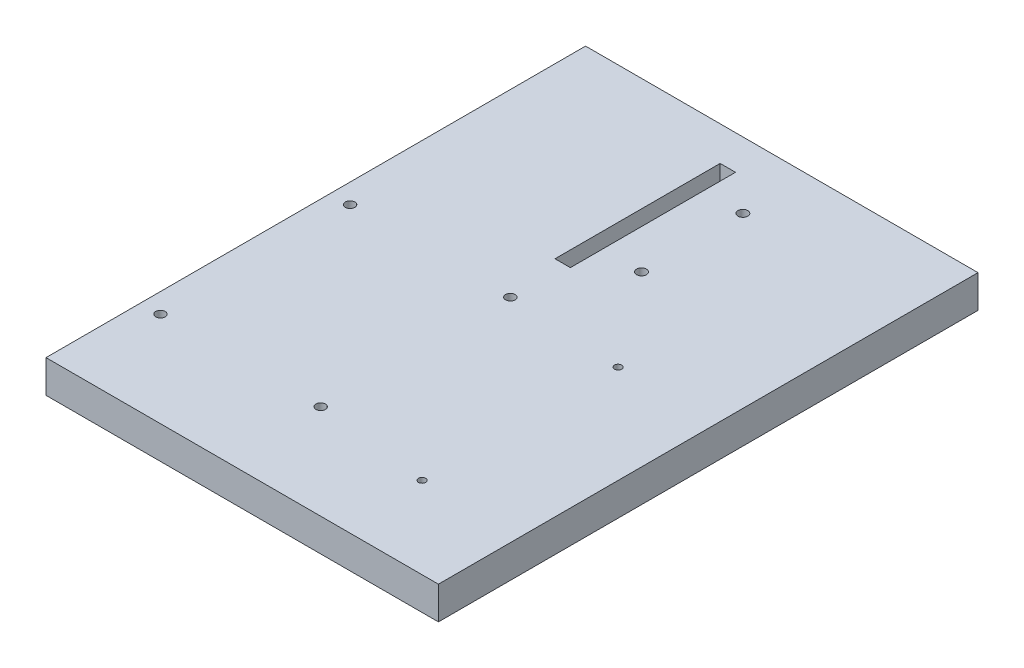
from build123d import *

# Parameters (mm, degrees)
SKETCH1_W                     = 120
SKETCH1_H                     = 165
BASE_DEPTH                    = 10
PI_MOUNTHOLES_AT_2_COUNT      = 2
PI_MOUNTHOLES_AT_2_PITCH      = 49
PI_MOUNTHOLES_AT_3_COUNT      = 2
PI_MOUNTHOLES_AT_3_PITCH      = 75.927597091
PI_MOUNTHOLES_AT_4_COUNT      = 2
PI_MOUNTHOLES_AT_4_PITCH      = 58
BATTERY_MOUNTHOLES_AT_2_COUNT = 2
BATTERY_MOUNTHOLES_AT_2_PITCH = 59.95
SKETCH17_W                    = 4.7
SKETCH17_H                    = 50.5
STEPPERBRACKETSLOT_DEPTH      = 10
SKETCH18_R                    = 1.5
ANGLEBRACKET_MOUNTHOLES_DEPTH = 10


with BuildPart() as part:
    # Sketch1 → Base (new body)
    with BuildSketch(Plane(origin=(0, 0, 0), x_dir=(1, 0, 0), z_dir=(0, 1, 0))):
        with Locations((60, 82.5)):
            Rectangle(SKETCH1_W, SKETCH1_H)
    extrude(amount=BASE_DEPTH)

    # Sketch14 → Pi-MountHoles (revolve, cut)
    with BuildSketch(Plane(origin=(6, 0, -29), x_dir=(0, 0, -1), z_dir=(1, 0, 0))):
        Polygon((0, 0), (0, 10), (1.45, 10), (1.45, 2.1), (3, 2.1), (3, 0.025), (3.025, 0), align=None)
    pi_mountholes = revolve(axis=Axis((6, -6.35, -29), (0, 1, 0)), mode=Mode.SUBTRACT)

    # Pi-MountHoles at 2: Pi-MountHoles ×2
    with Locations(*[(i * PI_MOUNTHOLES_AT_2_PITCH, 0, 0) for i in range(1, PI_MOUNTHOLES_AT_2_COUNT)]):
        add(pi_mountholes, mode=Mode.SUBTRACT)

    # Pi-MountHoles at 3: Pi-MountHoles ×2
    with Locations(*[Vector(0.6453516491682099, 0, -0.7638856255460447) * (i * PI_MOUNTHOLES_AT_3_PITCH) for i in range(1, PI_MOUNTHOLES_AT_3_COUNT)]):
        add(pi_mountholes, mode=Mode.SUBTRACT)

    # Pi-MountHoles at 4: Pi-MountHoles ×2
    with Locations(*[(0, 0, -i * PI_MOUNTHOLES_AT_4_PITCH) for i in range(1, PI_MOUNTHOLES_AT_4_COUNT)]):
        add(pi_mountholes, mode=Mode.SUBTRACT)

    # Sketch16 → Battery-MountHoles (revolve, cut)
    with BuildSketch(Plane(origin=(90, 0, -25), x_dir=(0, 0, -1), z_dir=(1, 0, 0))):
        Polygon((0, 0), (0, 10), (1.1, 10), (1.1, 1.6), (2.5, 1.6), (2.5, 0.025), (2.525, 0), align=None)
    battery_mountholes = revolve(axis=Axis((90, -6.35, -25), (0, 1, 0)), mode=Mode.SUBTRACT)

    # Battery-MountHoles at 2: Battery-MountHoles ×2
    with Locations(*[(0, 0, -i * BATTERY_MOUNTHOLES_AT_2_PITCH) for i in range(1, BATTERY_MOUNTHOLES_AT_2_COUNT)]):
        add(battery_mountholes, mode=Mode.SUBTRACT)

    # Sketch17 → StepperBracketSlot (cut)
    with BuildSketch(Plane(origin=(0, 10, 0), x_dir=(1, 0, 0), z_dir=(0, 1, 0))):
        with Locations((54, 129.25)):
            Rectangle(SKETCH17_W, SKETCH17_H)
    extrude(amount=-STEPPERBRACKETSLOT_DEPTH, mode=Mode.SUBTRACT)

    # Sketch18 → AngleBracket-MountHoles (cut)
    with BuildSketch(Plane(origin=(0, 10, 0), x_dir=(1, 0, 0), z_dir=(0, 1, 0))):
        with Locations(Location((68.35, 144.75, 0), (0, 0, 270))):
            Circle(SKETCH18_R)
        with Locations(Location((68.35, 113.75, 0), (0, 0, 270))):
            Circle(SKETCH18_R)
    extrude(amount=-ANGLEBRACKET_MOUNTHOLES_DEPTH, mode=Mode.SUBTRACT)


solid = part.part
